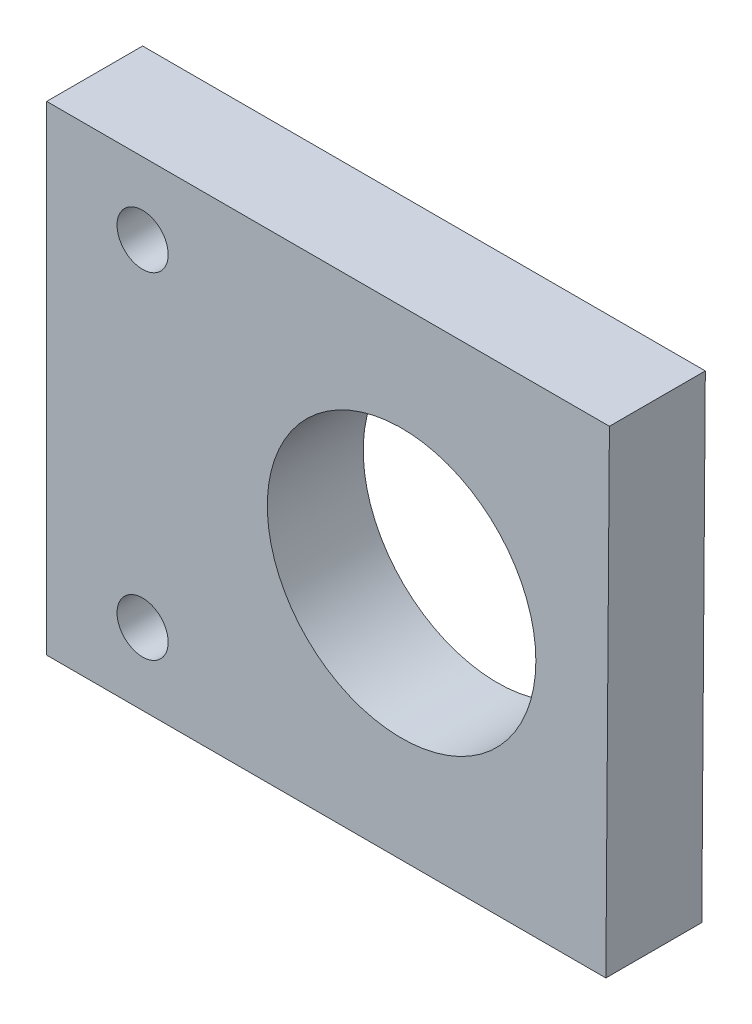
from build123d import *

# Parameters (mm, degrees)
SKETCH_1_R      = 4
SKETCH_1_R_2    = 21
EXTRUDE_1_DEPTH = 15


with BuildPart() as part:
    # 草图1 → 凸台-拉伸1 (new body)
    with BuildSketch(Plane.XY):
        Polygon((11, 37.5), (-19, 37.5), (-19, 26.25), (-19, 0), (-19, -37.5), (19, -37.5), (68.446354823, -37.5), (69, 37.5), (19, 37.5), align=None)
        with Locations((-4, -26.25)):
            Circle(SKETCH_1_R, mode=Mode.SUBTRACT)
        with Locations((-4, 26.25)):
            Circle(SKETCH_1_R, mode=Mode.SUBTRACT)
        with Locations((36.5, 0)):
            Circle(SKETCH_1_R_2, mode=Mode.SUBTRACT)
    extrude(amount=EXTRUDE_1_DEPTH)


solid = part.part
